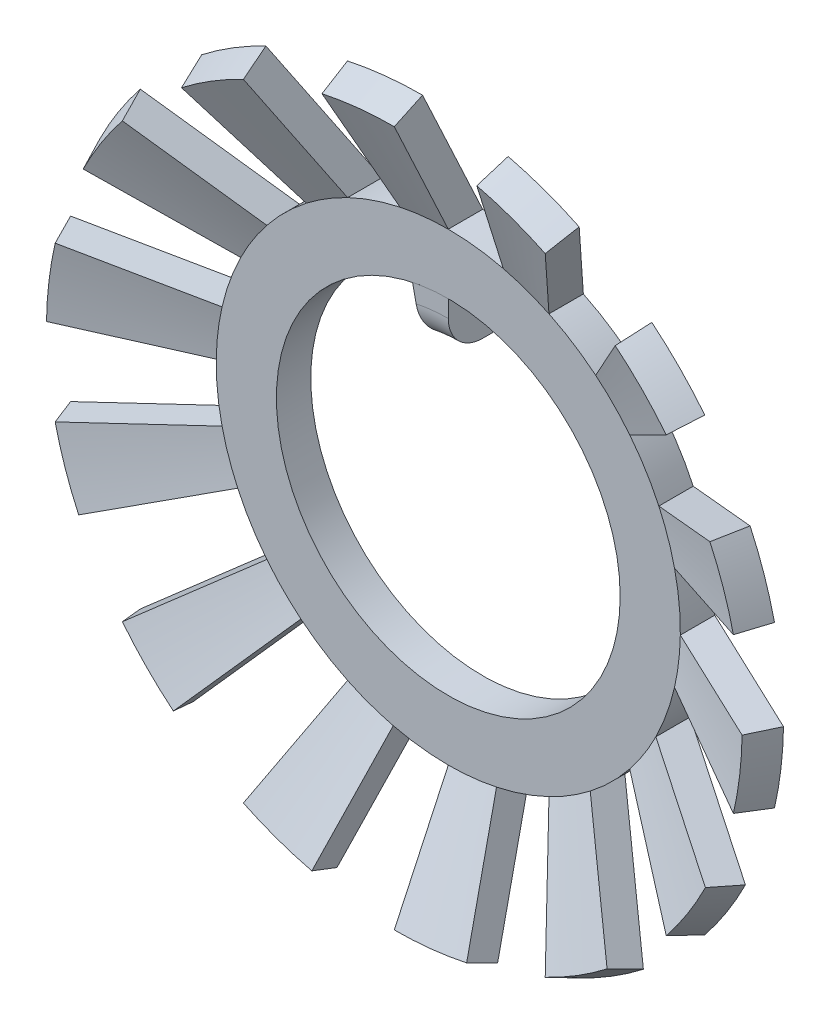
from build123d import *

# Parameters (mm, degrees)
SKETCH1_R           = 6.75
BOSS_EXTRUDE1_DEPTH = 1
SKETCH2_R           = 5
CUT_EXTRUDE1_DEPTH  = 1
REVOLVE3_ANGLE      = 12
CIRPATTERN1_COUNT   = 14
REVOLVE4_ANGLE      = 12


with BuildPart() as part:
    # Sketch1 → Boss-Extrude1 (new body)
    with BuildSketch(Plane.XY):
        Circle(SKETCH1_R)
    extrude(amount=BOSS_EXTRUDE1_DEPTH)

    # Sketch2 → Cut-Extrude1 (cut)
    with BuildSketch(Plane.XY.offset(1)):
        Circle(SKETCH2_R)
    extrude(amount=-CUT_EXTRUDE1_DEPTH, mode=Mode.SUBTRACT)

    # Sketch3 → Revolve3 (revolve)
    with BuildSketch(Plane(origin=(0, 0, 0), x_dir=(0, 0, -1), z_dir=(1, 0, 0))):
        Polygon((0, 6.75), (-1.74892584, 10.500583567), (-2.570319645, 10.117561345), (-1, 6.75), align=None)
    revolve3 = revolve(axis=Axis((0, 0, -0.128515982), (0, 0, 1)), revolution_arc=REVOLVE3_ANGLE)

    # CirPattern1: Revolve3 ×14 about axis
    cirpattern1_axis = Axis((0, 0, 0), (0, 0, 1))
    for i in range(1, CIRPATTERN1_COUNT):
        add(revolve3.rotate(cirpattern1_axis, i * 360 / CIRPATTERN1_COUNT))


with BuildPart() as body_2:
    # Sketch4 → Revolve4 (revolve)
    with BuildSketch(Plane(origin=(0, 0, 0), x_dir=(0, 0, -1), z_dir=(1, 0, 0))):
        with BuildLine():
            Line((0, 3.5), (1, 3.5))
            Line((1, 3.5), (1, 5))
            Line((1, 5), (-1, 5))
            Line((-1, 5), (-1, 4.5))
            ThreePointArc((-1, 4.5), (-0.707106781, 3.792893219), (0, 3.5))
        make_face()
    revolve(axis=Axis((0, 0, -0.128515982), (0, 0, 1)), revolution_arc=REVOLVE4_ANGLE)


solid = Compound([part.part, body_2.part])
